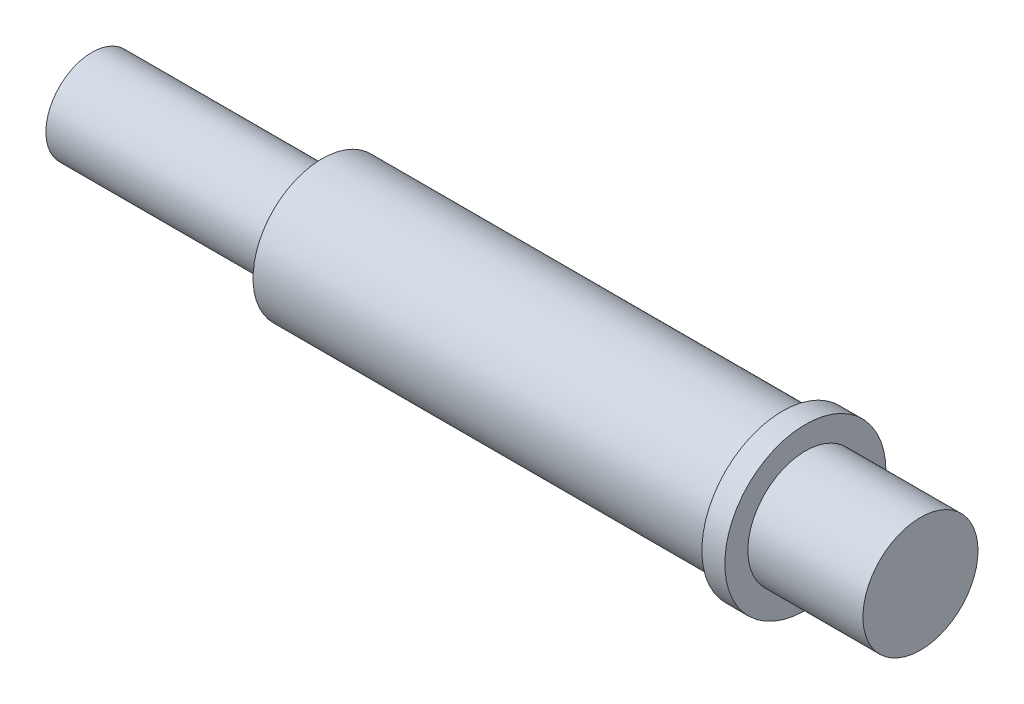
from build123d import *

# Parameters (mm, degrees)
SKETCH_3_R   = 20
PART_1_DEPTH = 100
SKETCH_4_R   = 30
PART_2_DEPTH = 200
SKETCH_5_R   = 35
PART_3_DEPTH = 10
SKETCH_6_R   = 25
PART_4_DEPTH = 50


with BuildPart() as part:
    # Эскиз3 → part-1 (new body)
    with BuildSketch(Plane(origin=(0, 0, 0), x_dir=(0, 0, -1), z_dir=(1, 0, 0))):
        Circle(SKETCH_3_R)
    extrude(amount=PART_1_DEPTH)

    # Эскиз4 → part-2 (add)
    with BuildSketch(Plane(origin=(100, 0, 0), x_dir=(0, 0, -1), z_dir=(1, 0, 0))):
        Circle(SKETCH_4_R)
    extrude(amount=PART_2_DEPTH)

    # Эскиз5 → part-3 (add)
    with BuildSketch(Plane(origin=(300, 0, 0), x_dir=(0, 0, -1), z_dir=(1, 0, 0))):
        Circle(SKETCH_5_R)
    extrude(amount=PART_3_DEPTH)

    # Эскиз6 → part-4 (add)
    with BuildSketch(Plane(origin=(310, 0, 0), x_dir=(0, 0, -1), z_dir=(1, 0, 0))):
        Circle(SKETCH_6_R)
    extrude(amount=PART_4_DEPTH)


solid = part.part
